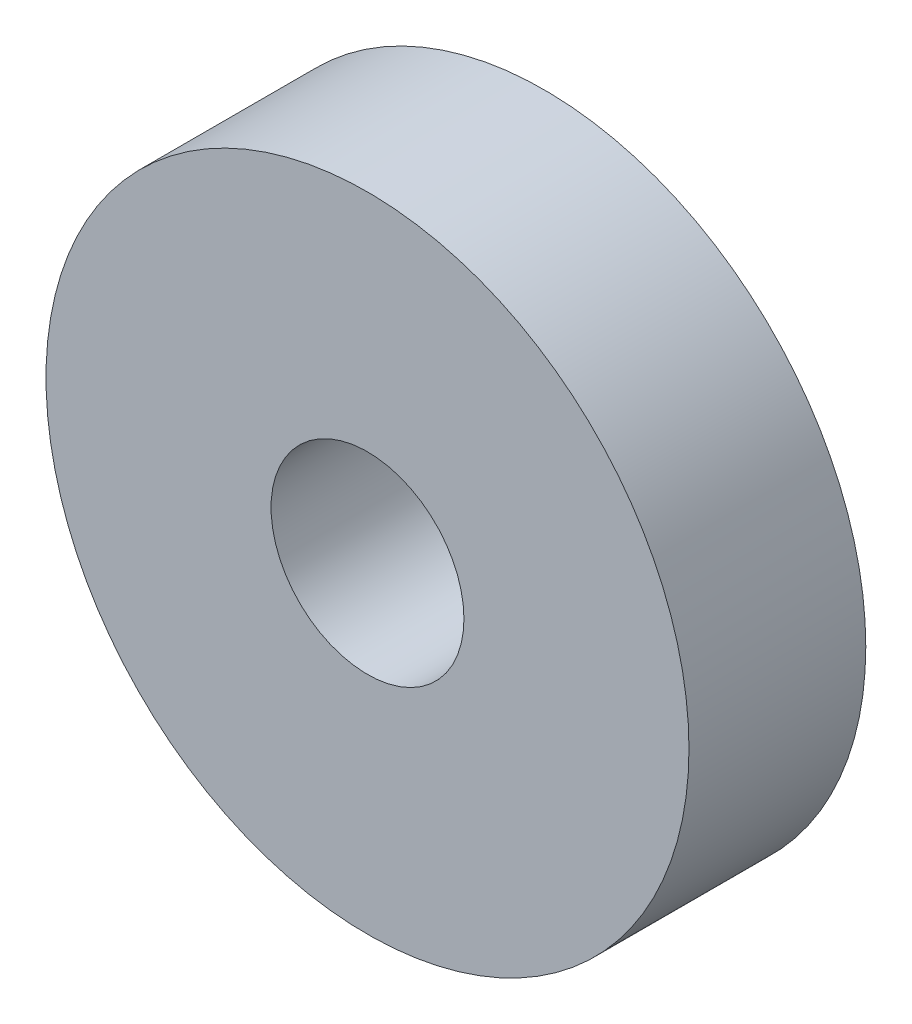
from build123d import *

# Parameters (mm, degrees)
SKETCH1_R           = 20
SKETCH1_R_2         = 6
BOSS_EXTRUDE1_DEPTH = 11


with BuildPart() as part:
    # Sketch1 → Boss-Extrude1 (new body)
    with BuildSketch(Plane.XY):
        with Locations((12, 17)):
            Circle(SKETCH1_R)
        with Locations((12, 17)):
            Circle(SKETCH1_R_2, mode=Mode.SUBTRACT)
    extrude(amount=BOSS_EXTRUDE1_DEPTH)


solid = part.part
